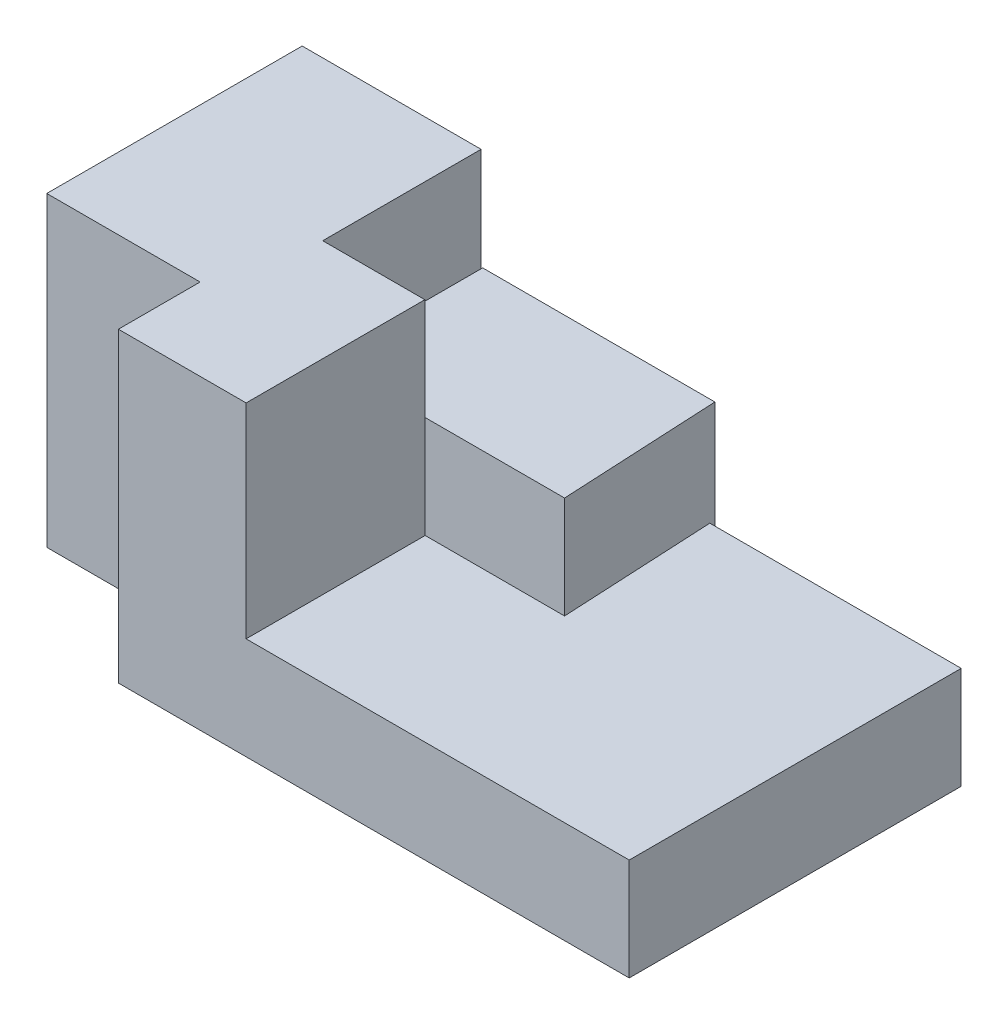
from build123d import *

# Parameters (mm, degrees)
SKETCH1_W           = 190.5
SKETCH1_H           = 165.1
BOSS_EXTRUDE1_DEPTH = 50.8
SKETCH2_W           = 88.9
SKETCH2_H           = 152.4
BOSS_EXTRUDE2_DEPTH = 63.5
BOSS_EXTRUDE3_DEPTH = 152.4
BOSS_EXTRUDE4_DEPTH = 93.98


with BuildPart() as part:
    # Sketch1 → Boss-Extrude1 (new body)
    with BuildSketch(Plane(origin=(0, 0, 0), x_dir=(1, 0, 0), z_dir=(0, 1, 0))):
        Rectangle(SKETCH1_W, SKETCH1_H)
    extrude(amount=BOSS_EXTRUDE1_DEPTH)

    # Sketch2 → Boss-Extrude2 (add)
    with BuildSketch(Plane.ZY.offset(95.25)):
        with Locations((38.1, 76.2)):
            Rectangle(SKETCH2_W, SKETCH2_H)
    extrude(amount=BOSS_EXTRUDE2_DEPTH)

    # Sketch3 → Boss-Extrude3 (add)
    with BuildSketch(Plane(origin=(0, 152.4, 0), x_dir=(1, 0, 0), z_dir=(0, 1, 0))):
        Polygon((-158.75, 6.35), (-146.05, 6.35), (-146.05, 85.09), (-235.014810015, 85.09), (-235.014810015, -41.91), (-158.75, -41.91), align=None)
    extrude(amount=-BOSS_EXTRUDE3_DEPTH)

    # Sketch9 → Boss-Extrude4 (add)
    with BuildSketch(Plane(origin=(0, 101.6, 0), x_dir=(1, 0, 0), z_dir=(0, 1, 0))):
        Polygon((-145.392235631, 6.475919558), (-145.392235631, 85.217024974), (-29.908989465, 85.217024974), (-25.920545989, 6.475919558), align=None)
    extrude(amount=-BOSS_EXTRUDE4_DEPTH)


solid = part.part
